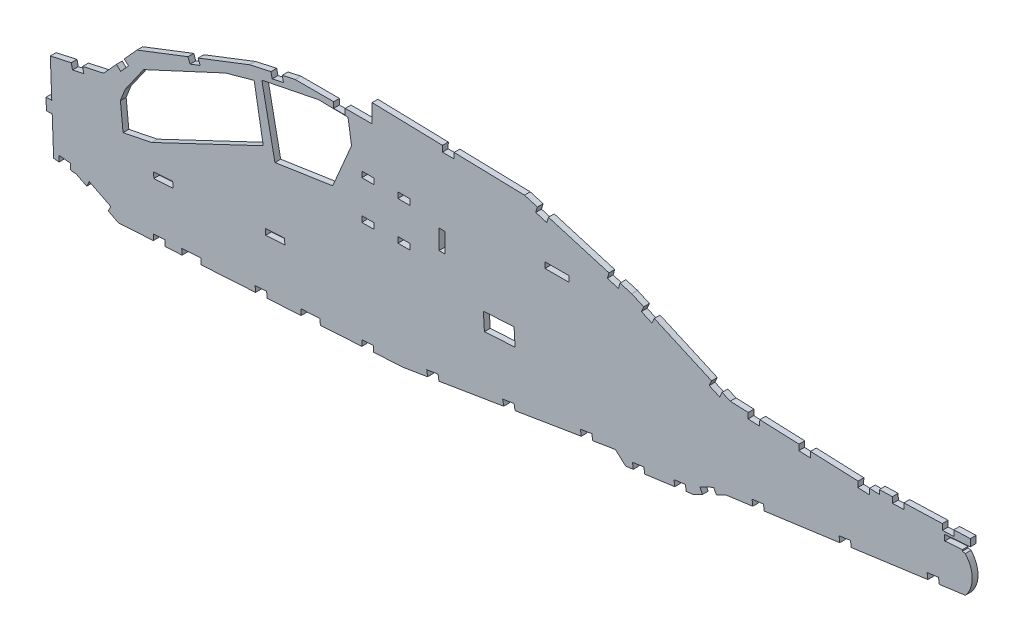
from build123d import *

# Parameters (mm, degrees)
SKETCH1_W           = 6.35
SKETCH1_H           = 1.524
SKETCH1_W_2         = 1.524
SKETCH1_H_2         = 5.1562
SKETCH1_W_3         = 3.175
BOSS_EXTRUDE1_DEPTH = 1.524
SKETCH2_W           = 5.08
SKETCH2_H           = 1.524
CUT_EXTRUDE1_DEPTH  = 1.524
CUT_EXTRUDE2_DEPTH  = 1.524


with BuildPart() as part:
    # Sketch1 → Boss-Extrude1 (new body)
    with BuildSketch(Plane.XY):
        with BuildLine():
            Line((244.116606528, 82.911327357), (237.252617779, 81.969806776))
            Line((237.252617779, 81.969806776), (237.045512802, 83.479668866))
            Line((237.045512802, 83.479668866), (234.025788624, 83.065458912))
            Line((234.025788624, 83.065458912), (234.232893601, 81.555596823))
            Line((234.232893601, 81.555596823), (214.003784743, 78.780807555))
            Line((214.003784743, 78.780807555), (213.796679766, 80.290669644))
            Line((213.796679766, 80.290669644), (210.776955588, 79.87645969))
            Line((210.776955588, 79.87645969), (210.984060564, 78.366597601))
            Line((210.984060564, 78.366597601), (191.039430514, 75.630829762))
            Line((191.039430514, 75.630829762), (190.832325538, 77.140691852))
            Line((190.832325538, 77.140691852), (187.812601359, 76.726481898))
            Line((187.812601359, 76.726481898), (188.019706336, 75.216619809))
            Line((188.019706336, 75.216619809), (180.87123878, 74.236077799))
            Line((180.87123878, 74.236077799), (178.362737599, 73.022286905))
            Line((178.362737599, 73.022286905), (177.698942745, 74.394129604))
            Line((177.698942745, 74.394129604), (174.040695547, 72.624009992))
            Line((174.040695547, 72.624009992), (174.704490402, 71.252167293))
            Line((174.704490402, 71.252167293), (172.195989221, 70.038376399))
            Line((172.195989221, 70.038376399), (170.429973786, 69.796135344))
            Line((170.429973786, 69.796135344), (170.22286881, 71.305997433))
            Line((170.22286881, 71.305997433), (167.203144631, 70.89178748))
            Line((167.203144631, 70.89178748), (167.410249608, 69.381925391))
            Line((167.410249608, 69.381925391), (159.477725394, 68.293835786))
            Line((159.477725394, 68.293835786), (159.270620417, 69.803697875))
            Line((159.270620417, 69.803697875), (156.250896238, 69.389487922))
            Line((156.250896238, 69.389487922), (156.458001215, 67.879625832))
            Line((156.458001215, 67.879625832), (154.441990605, 67.603093403))
            Line((154.441990605, 67.603093403), (151.740691484, 70.052140515))
            Line((151.740691484, 70.052140515), (145.722537425, 69.060863674))
            Line((145.722537425, 69.060863674), (145.516521383, 70.571465208))
            Line((145.516521383, 70.571465208), (142.507891466, 70.075900433))
            Line((142.507891466, 70.075900433), (142.713907508, 68.565298899))
            Line((142.713907508, 68.565298899), (125.238820776, 65.686899872))
            Line((125.238820776, 65.686899872), (124.991133475, 67.190637549))
            Line((124.991133475, 67.190637549), (121.983658121, 66.695262947))
            Line((121.983658121, 66.695262947), (122.231345422, 65.19152527))
            Line((122.231345422, 65.19152527), (105.161874969, 62.379937099))
            Line((105.161874969, 62.379937099), (104.914187668, 63.883674776))
            Line((104.914187668, 63.883674776), (101.906712314, 63.388300174))
            Line((101.906712314, 63.388300174), (102.154399615, 61.884562497))
            Line((102.154399615, 61.884562497), (95.729474714, 60.826284626))
            Line((95.729474714, 60.826284626), (87.833574041, 60.346980553))
            Line((87.833574041, 60.346980553), (87.833574041, 61.873785821))
            Line((87.833574041, 61.873785821), (84.785574041, 61.68876338))
            Line((84.785574041, 61.68876338), (84.785574041, 60.161958112))
            Line((84.785574041, 60.161958112), (59.750399316, 58.64225039))
            Line((59.750399316, 58.64225039), (59.658058071, 60.163450276))
            Line((59.658058071, 60.163450276), (56.615658298, 59.978767786))
            Line((56.615658298, 59.978767786), (56.707999544, 58.457567899))
            Line((56.707999544, 58.457567899), (32.791601482, 57.005773166))
            Line((32.791601482, 57.005773166), (32.791601482, 58.532578434))
            Line((32.791601482, 58.532578434), (29.743601482, 58.347555993))
            Line((29.743601482, 58.347555993), (29.743601482, 56.820750725))
            Line((29.743601482, 56.820750725), (20.572549364, 56.26404126))
            Line((20.572549364, 56.26404126), (17.824257892, 57.638406665))
            Line((17.824257892, 57.638406665), (18.505898569, 59.001470122))
            Line((18.505898569, 59.001470122), (12.826467498, 61.841639608))
            Line((12.826467498, 61.841639608), (12.144826821, 60.478576151))
            Line((12.144826821, 60.478576151), (9.396535348, 61.852941556))
            Line((9.396535348, 61.852941556), (7.893467708, 62.011159202))
            Line((7.893467708, 62.011159202), (7.893467708, 63.566750033))
            Line((7.893467708, 63.566750033), (4.84726288, 63.887403173))
            Line((4.84726288, 63.887403173), (4.84726288, 62.331812342))
            Line((4.84726288, 62.331812342), (3.417930273, 62.482268406))
            Line((3.417930273, 62.482268406), (3.035874189, 72.45045898))
            Line((3.035874189, 72.45045898), (1.512992334, 72.392090686))
            Line((1.512992334, 72.392090686), (1.396170035, 75.440090686))
            Line((1.396170035, 75.440090686), (2.919051889, 75.49845898))
            Line((2.919051889, 75.49845898), (2.538017668, 85.439988195))
            Line((2.538017668, 85.439988195), (8.075100427, 86.660023379))
            Line((8.075100427, 86.660023379), (8.403030984, 85.171723158))
            Line((8.403030984, 85.171723158), (11.379631428, 85.827584272))
            Line((11.379631428, 85.827584272), (11.05170087, 87.315884494))
            Line((11.05170087, 87.315884494), (16.629009874, 88.544783088))
            Line((16.629009874, 88.544783088), (19.988701626, 92.250523306))
            Line((19.988701626, 92.250523306), (21.125652927, 91.219742494))
            Line((21.125652927, 91.219742494), (23.18721455, 93.493645096))
            Line((23.18721455, 93.493645096), (22.050263249, 94.524425908))
            Line((22.050263249, 94.524425908), (25.409955001, 98.230166125))
            Line((25.409955001, 98.230166125), (38.875976231, 103.43890924))
            Line((38.875976231, 103.43890924), (39.425772274, 102.017536555))
            Line((39.425772274, 102.017536555), (42.100143996, 103.052000637))
            Line((42.100143996, 103.052000637), (41.550347953, 104.473373322))
            Line((41.550347953, 104.473373322), (55.204618635, 109.754932529))
            Line((55.204618635, 109.754932529), (57.414712199, 110.241902297))
            Line((57.414712199, 110.241902297), (60.790035454, 110.985617591))
            Line((60.790035454, 110.985617591), (61.117966011, 109.497317369))
            Line((61.117966011, 109.497317369), (64.094566454, 110.153178484))
            Line((64.094566454, 110.153178484), (63.766635897, 111.641478705))
            Line((63.766635897, 111.641478705), (67.141959152, 112.385193999))
            Line((67.141959152, 112.385193999), (70.250833465, 112.385193999))
            Line((70.250833465, 112.385193999), (77.348696564, 112.385193999))
            Line((77.348696564, 112.385193999), (77.348696564, 110.861193999))
            Line((77.348696564, 110.861193999), (80.396696564, 110.861193999))
            Line((80.396696564, 110.861193999), (80.396696564, 112.385193999))
            Line((80.396696564, 112.385193999), (87.494559664, 112.385193999))
            Line((87.494559664, 112.385193999), (87.494559664, 117.259700181))
            Line((87.494559664, 117.259700181), (106.090754629, 116.772448666))
            Line((106.090754629, 116.772448666), (106.049791062, 115.209053874))
            Line((106.049791062, 115.209053874), (109.099883599, 115.209053874))
            Line((109.099883599, 115.209053874), (109.138754629, 116.692585952))
            Line((109.138754629, 116.692585952), (127.734949594, 116.205334437))
            Line((127.734949594, 116.205334437), (131.128393435, 115.200142432))
            Line((131.128393435, 115.200142432), (130.695550826, 113.738902111))
            Line((130.695550826, 113.738902111), (133.618031467, 112.873216892))
            Line((133.618031467, 112.873216892), (134.050874077, 114.334457213))
            Line((134.050874077, 114.334457213), (150.037949629, 109.598831317))
            Line((150.037949629, 109.598831317), (149.605107019, 108.137590996))
            Line((149.605107019, 108.137590996), (152.527587661, 107.271905776))
            Line((152.527587661, 107.271905776), (152.96043027, 108.733146097))
            Line((152.96043027, 108.733146097), (156.007216108, 107.830639703))
            Line((156.007216108, 107.830639703), (159.206682155, 106.409236339))
            Line((159.206682155, 106.409236339), (158.587938534, 105.016493603))
            Line((158.587938534, 105.016493603), (161.373424007, 103.779006359))
            Line((161.373424007, 103.779006359), (161.992167629, 105.171749095))
            Line((161.992167629, 105.171749095), (177.117665339, 98.452054932))
            Line((177.117665339, 98.452054932), (176.498921717, 97.059312196))
            Line((176.498921717, 97.059312196), (179.28440719, 95.821824952))
            Line((179.28440719, 95.821824952), (179.903150812, 97.214567688))
            Line((179.903150812, 97.214567688), (182.046724155, 96.262258048))
            Line((182.046724155, 96.262258048), (186.813706946, 96.066697828))
            Line((186.813706946, 96.066697828), (186.751239067, 94.543978628))
            Line((186.751239067, 94.543978628), (189.796677469, 94.419042871))
            Line((189.796677469, 94.419042871), (189.859145347, 95.941762071))
            Line((189.859145347, 95.941762071), (200.205568545, 95.517311452))
            Line((200.205568545, 95.517311452), (200.143100667, 93.994592252))
            Line((200.143100667, 93.994592252), (203.188539068, 93.869656495))
            Line((203.188539068, 93.869656495), (203.251006947, 95.392375695))
            Line((203.251006947, 95.392375695), (215.802619169, 94.877459625))
            Line((215.802619169, 94.877459625), (215.74015129, 93.354740424))
            Line((215.74015129, 93.354740424), (218.785589692, 93.229804667))
            Line((218.785589692, 93.229804667), (218.84805757, 94.752523868))
            Line((218.84805757, 94.752523868), (221.409851338, 94.647429099))
            Line((221.409851338, 94.647429099), (221.409851338, 95.729536762))
            Line((221.409851338, 95.729536762), (224.862525748, 95.84320801))
            Line((224.862525748, 95.84320801), (224.912672722, 94.320033273))
            Line((224.912672722, 94.320033273), (227.959022197, 94.420327221))
            Line((227.959022197, 94.420327221), (227.908875223, 95.943501959))
            Line((227.908875223, 95.943501959), (238.035430049, 96.276895147))
            Line((238.035430049, 96.276895147), (238.085577023, 94.753720409))
            Line((238.085577023, 94.753720409), (241.131926498, 94.854014358))
            Line((241.131926498, 94.854014358), (241.081779524, 96.377189095))
            Line((241.081779524, 96.377189095), (245.446531334, 96.520888364))
            Line((245.446531334, 96.520888364), (245.446531334, 94.647430653))
            Line((245.446531334, 94.647430653), (238.574697832, 94.129069175))
            Line((238.574697832, 94.129069175), (238.689331707, 92.609386618))
            Line((238.689331707, 92.609386618), (243.34901924, 92.960879784))
            Line((243.34901924, 92.960879784), (243.34901924, 92.610161839))
            Line((243.34901924, 92.610161839), (244.116606528, 92.438708608))
            ThreePointArc((244.116606528, 92.438708608), (245.946266022, 87.675017982), (244.116606528, 82.911327357))
        make_face()
        Polygon((117.150680964, 79.70334264), (116.874994855, 84.244906663), (124.976101242, 84.736667318), (125.251787351, 80.195103296), align=None, mode=Mode.SUBTRACT)
        Polygon((21.742851213, 77.504933786), (21.033011779, 84.485021562), (22.294948552, 87.675017982), (27.184953547, 94.6474291), (41.943930186, 101.489898115), (48.792610594, 104.665042613), (56.359375563, 106.769571), (58.755699389, 93.026355823), (29.253028649, 79.022449298), align=None, mode=Mode.SUBTRACT)
        Polygon((58.388008375, 107.830639703), (61.843527976, 90.72928876), (77.094115889, 93.026355823), (82.060659938, 104.665042613), (81.149309551, 110.715640535), (73.385120037, 110.860974176), align=None, mode=Mode.SUBTRACT)
        with Locations((136.324715103, 102.918148685)):
            Rectangle(SKETCH1_W, SKETCH1_H, mode=Mode.SUBTRACT)
        with Locations((105.923874969, 94.831725533)):
            Rectangle(SKETCH1_W_2, SKETCH1_H_2, mode=Mode.SUBTRACT)
        with Locations((86.373074041, 99.489585444)):
            Rectangle(SKETCH1_W_3, SKETCH1_H, mode=Mode.SUBTRACT)
        with Locations((95.898074041, 99.489585444)):
            Rectangle(SKETCH1_W_3, SKETCH1_H, mode=Mode.SUBTRACT)
        with Locations((86.373074041, 89.279487225)):
            Rectangle(SKETCH1_W_3, SKETCH1_H, mode=Mode.SUBTRACT)
        with Locations((95.898074041, 89.279487225)):
            Rectangle(SKETCH1_W_3, SKETCH1_H, mode=Mode.SUBTRACT)
    extrude(amount=BOSS_EXTRUDE1_DEPTH)

    # Sketch2 → Cut-Extrude1 (cut)
    with BuildSketch(Plane(origin=(-3.327323244, 54.81324967, 0), x_dir=(-0.9981626551196875, -0.06059136839860878, 0), z_dir=(0.06059136839860877, -0.9981626551196874, 0))):
        with Locations((-43.257700005, -0.762)):
            Rectangle(SKETCH2_W, SKETCH2_H)
        with Locations((-74.760143281, -0.762)):
            Rectangle(SKETCH2_W, SKETCH2_H)
    extrude(amount=-CUT_EXTRUDE1_DEPTH, mode=Mode.SUBTRACT)

    # Sketch3 → Cut-Extrude2 (cut)
    with BuildSketch(Plane.XY.offset(1.524)):
        Polygon((29.778568765, 72.599861108), (29.87091001, 71.078661222), (34.941576298, 71.386465373), (34.849235053, 72.90766526), align=None)
        Polygon((64.375200149, 74.699976983), (64.467541394, 73.178777096), (59.396875106, 72.870972945), (59.304533861, 74.392172831), align=None)
    extrude(amount=-CUT_EXTRUDE2_DEPTH, mode=Mode.SUBTRACT)


solid = part.part
